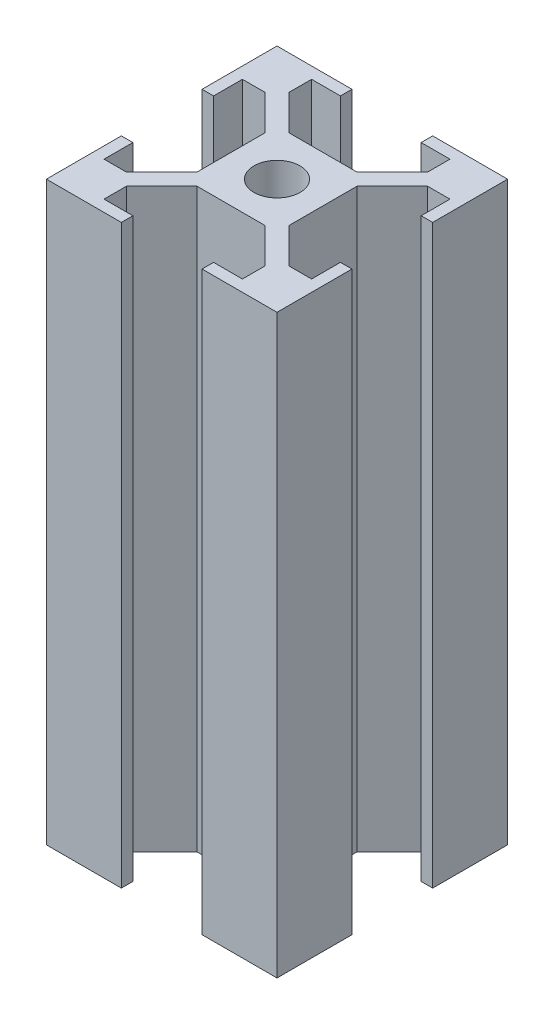
from build123d import *

# Parameters (mm, degrees)
SKETCH1_W               = 40
SKETCH1_H               = 40
BOSS_EXTRUDE1_DEPTH     = 100
CUT_EXTRUDE1_DEPTH      = 104.923048454
CUT_EXTRUDE1_DEPTH_BACK = 104.923048454
SKETCH2_R               = 4


with BuildPart() as part:
    # Sketch1 → Boss-Extrude1 (new body)
    with BuildSketch(Plane(origin=(0, 0, 0), x_dir=(1, 0, 0), z_dir=(0, 1, 0))):
        Rectangle(SKETCH1_W, SKETCH1_H)
    extrude(amount=BOSS_EXTRUDE1_DEPTH)

    # Sketch2 → Cut-Extrude1 (cut, two sides: drawn at the far end of the back side and taken through both)
    with BuildSketch(Plane(origin=(0, 100, 0), x_dir=(1, 0, 0), z_dir=(0, 1, 0)).offset(-CUT_EXTRUDE1_DEPTH_BACK)):
        with Locations(Location((0, 0, 0), (0, 0, 270))):
            Circle(SKETCH2_R)
        Polygon((-7, 20), (-7, 18), (-12, 18), (-12, 14.121320344), (-5.878679656, 8), (5.878679656, 8), (12, 14.121320344), (12, 18), (7, 18), (7, 20), align=None)
        Polygon((20, 7), (18, 7), (18, 12), (14.121320344, 12), (8, 5.878679656), (8, -5.878679656), (14.121320344, -12), (18, -12), (18, -7), (20, -7), align=None)
        Polygon((7, -20), (7, -18), (12, -18), (12, -14.121320344), (5.878679656, -8), (-5.878679656, -8), (-12, -14.121320344), (-12, -18), (-7, -18), (-7, -20), align=None)
        Polygon((-20, -7), (-18, -7), (-18, -12), (-14.121320344, -12), (-8, -5.878679656), (-8, 5.878679656), (-14.121320344, 12), (-18, 12), (-18, 7), (-20, 7), align=None)
    extrude(amount=CUT_EXTRUDE1_DEPTH + CUT_EXTRUDE1_DEPTH_BACK, mode=Mode.SUBTRACT)


solid = part.part
